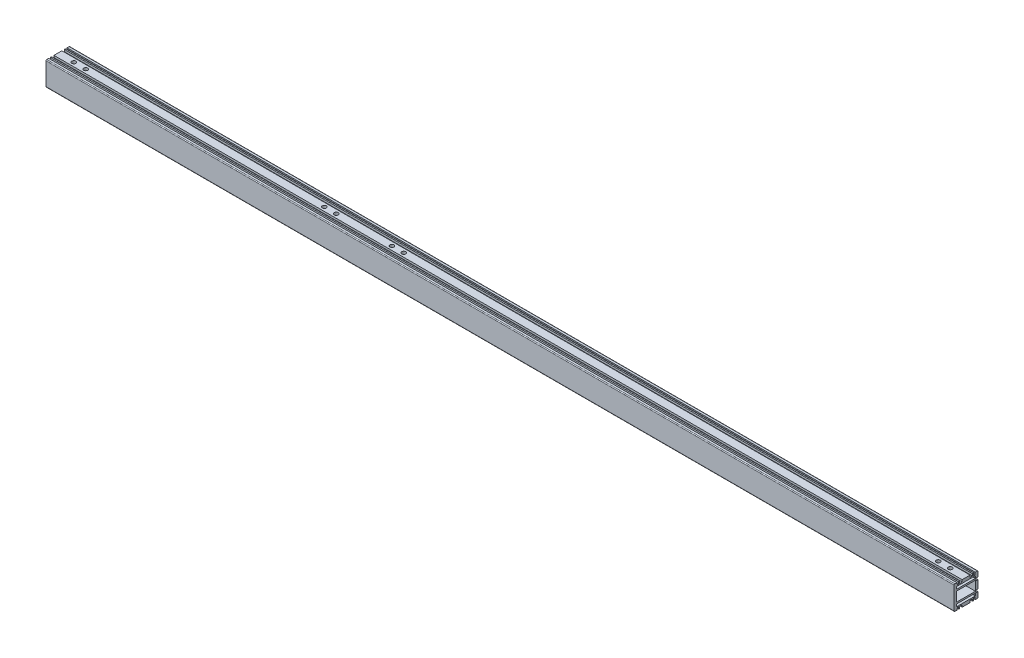
from build123d import *

# Parameters (mm, degrees)
SKETCH_1_W             = 23.5
SKETCH_1_H             = 12
EXTRUDE_1_DEPTH        = 571
HOLE_WIZARD_M6_1_D     = 5
HOLE_WIZARD_M6_1_DEPTH = 15
HOLE_WIZARD_M6_1_TIP   = 1.502151548
HOLE_WIZARD_M6_2_D     = 5
HOLE_WIZARD_M6_2_DEPTH = 15
HOLE_WIZARD_M6_2_TIP   = 1.502151548
HOLE_WIZARD_M6_3_D     = 5
HOLE_WIZARD_M6_3_DEPTH = 15
HOLE_WIZARD_M6_3_TIP   = 1.502151548
HOLE_WIZARD_M4_1_D     = 3.3
HOLE_WIZARD_M4_1_DEPTH = 10.1
HOLE_WIZARD_M4_1_TIP   = 0.991420021


with BuildPart() as part:
    # 草图1 → 凸台-拉伸1 (new, symmetric)
    with BuildSketch(Plane(origin=(0, 0, 0), x_dir=(0, 0, -1), z_dir=(1, 0, 0))):
        with BuildLine():
            Line((-14, 15), (-11.5, 15))
            Line((-11.5, 15), (-11.5, 13.5))
            Line((-11.5, 13.5), (-11.4, 13.5))
            ThreePointArc((-11.4, 13.5), (-11.117157288, 13.382842712), (-11, 13.1))
            Line((-11, 13.1), (-11, 12))
            Line((-11, 12), (-9.5, 12))
            Line((-9.5, 12), (-9.5, 15))
            Line((-9.5, 15), (-8, 15))
            Line((-8, 15), (-8, 12.5))
            Line((-8, 12.5), (-5, 12.5))
            Line((-5, 12.5), (-5, 15))
            Line((-5, 15), (5, 15))
            Line((5, 15), (5, 12.5))
            Line((5, 12.5), (8, 12.5))
            Line((8, 12.5), (8, 15))
            Line((8, 15), (9.5, 15))
            Line((9.5, 15), (9.5, 12))
            Line((9.5, 12), (11, 12))
            Line((11, 12), (11, 13.1))
            ThreePointArc((11, 13.1), (11.117157288, 13.382842712), (11.4, 13.5))
            Line((11.4, 13.5), (11.5, 13.5))
            Line((11.5, 13.5), (11.5, 15))
            Line((11.5, 15), (14, 15))
            ThreePointArc((14, 15), (14.707106781, 14.707106781), (15, 14))
            Line((15, 14), (15, 8))
            Line((15, 8), (12.5, 8))
            Line((12.5, 8), (12.5, 5))
            Line((12.5, 5), (15, 5))
            Line((15, 5), (15, -5))
            Line((15, -5), (12.5, -5))
            Line((12.5, -5), (12.5, -8))
            Line((12.5, -8), (15, -8))
            Line((15, -8), (15, -14))
            ThreePointArc((15, -14), (14.707106781, -14.707106781), (14, -15))
            Line((14, -15), (11.5, -15))
            Line((11.5, -15), (11.5, -13.5))
            Line((11.5, -13.5), (11.4, -13.5))
            ThreePointArc((11.4, -13.5), (11.117157288, -13.382842712), (11, -13.1))
            Line((11, -13.1), (11, -12))
            Line((11, -12), (9.5, -12))
            Line((9.5, -12), (9.5, -15))
            Line((9.5, -15), (8, -15))
            Line((8, -15), (8, -12.5))
            Line((8, -12.5), (5, -12.5))
            Line((5, -12.5), (5, -15))
            Line((5, -15), (-5, -15))
            Line((-5, -15), (-5, -12.5))
            Line((-5, -12.5), (-8, -12.5))
            Line((-8, -12.5), (-8, -15))
            Line((-8, -15), (-9.5, -15))
            Line((-9.5, -15), (-9.5, -12))
            Line((-9.5, -12), (-11, -12))
            Line((-11, -12), (-11, -13.1))
            ThreePointArc((-11, -13.1), (-11.117157288, -13.382842712), (-11.4, -13.5))
            Line((-11.4, -13.5), (-11.5, -13.5))
            Line((-11.5, -13.5), (-11.5, -15))
            Line((-11.5, -15), (-14, -15))
            ThreePointArc((-14, -15), (-14.707106781, -14.707106781), (-15, -14))
            Line((-15, -14), (-15, 14))
            ThreePointArc((-15, 14), (-14.707106781, 14.707106781), (-14, 15))
        make_face()
        with BuildLine():
            Line((12, -10.5), (12, -8.5))
            ThreePointArc((12, -8.5), (11.853553391, -8.146446609), (11.5, -8))
            Line((11.5, -8), (-11.5, -8))
            ThreePointArc((-11.5, -8), (-11.853553391, -8.146446609), (-12, -8.5))
            Line((-12, -8.5), (-12, -10.5))
            ThreePointArc((-12, -10.5), (-11.853553391, -10.853553391), (-11.5, -11))
            Line((-11.5, -11), (11.5, -11))
            ThreePointArc((11.5, -11), (11.853553391, -10.853553391), (12, -10.5))
        make_face(mode=Mode.SUBTRACT)
        with BuildLine():
            Line((-11.5, 11), (11.5, 11))
            ThreePointArc((11.5, 11), (11.853553391, 10.853553391), (12, 10.5))
            Line((12, 10.5), (12, 8.5))
            ThreePointArc((12, 8.5), (11.853553391, 8.146446609), (11.5, 8))
            Line((11.5, 8), (-11.5, 8))
            ThreePointArc((-11.5, 8), (-11.853553391, 8.146446609), (-12, 8.5))
            Line((-12, 8.5), (-12, 10.5))
            ThreePointArc((-12, 10.5), (-11.853553391, 10.853553391), (-11.5, 11))
        make_face(mode=Mode.SUBTRACT)
        Rectangle(SKETCH_1_W, SKETCH_1_H, mode=Mode.SUBTRACT)
    extrude(amount=EXTRUDE_1_DEPTH, both=True)

    # M6 螺纹孔1
    with Locations(Plane(origin=(0, 15, 0), x_dir=(-1, 0, 0), z_dir=(0, 1, 0))):
        with Locations((551, 0), (536, 0), (236, 0), (221, 0), (151, 0), (136, 0), (-536, 0), (-551, 0)):
            Hole(HOLE_WIZARD_M6_1_D / 2, depth=HOLE_WIZARD_M6_1_DEPTH)
            with Locations((0, 0, -(HOLE_WIZARD_M6_1_DEPTH + HOLE_WIZARD_M6_1_TIP / 2))):  # 118° drill point
                Cone(0, HOLE_WIZARD_M6_1_D / 2, HOLE_WIZARD_M6_1_TIP, mode=Mode.SUBTRACT)

    # M6 螺纹孔2
    with Locations(Plane.XZ.offset(15)):
        with Locations((-551, 0), (-536, 0), (536, 0), (551, 0)):
            Hole(HOLE_WIZARD_M6_2_D / 2, depth=HOLE_WIZARD_M6_2_DEPTH)
            with Locations((0, 0, -(HOLE_WIZARD_M6_2_DEPTH + HOLE_WIZARD_M6_2_TIP / 2))):  # 118° drill point
                Cone(0, HOLE_WIZARD_M6_2_D / 2, HOLE_WIZARD_M6_2_TIP, mode=Mode.SUBTRACT)

    # M6 螺纹孔3
    with Locations(Plane(origin=(0, 0, -15), x_dir=(-1, 0, 0), z_dir=(0, 0, -1))):
        with Locations((293.5, 0), (218.5, 0)):
            Hole(HOLE_WIZARD_M6_3_D / 2, depth=HOLE_WIZARD_M6_3_DEPTH)
            with Locations((0, 0, -(HOLE_WIZARD_M6_3_DEPTH + HOLE_WIZARD_M6_3_TIP / 2))):  # 118° drill point
                Cone(0, HOLE_WIZARD_M6_3_D / 2, HOLE_WIZARD_M6_3_TIP, mode=Mode.SUBTRACT)

    # M4 螺纹孔1
    with Locations(Plane.XZ.offset(15)):
        with Locations((-326, 0), (-131, 0), (64, 0), (259, 0), (454, 0)):
            Hole(HOLE_WIZARD_M4_1_D / 2, depth=HOLE_WIZARD_M4_1_DEPTH)
            with Locations((0, 0, -(HOLE_WIZARD_M4_1_DEPTH + HOLE_WIZARD_M4_1_TIP / 2))):  # 118° drill point
                Cone(0, HOLE_WIZARD_M4_1_D / 2, HOLE_WIZARD_M4_1_TIP, mode=Mode.SUBTRACT)


solid = part.part
